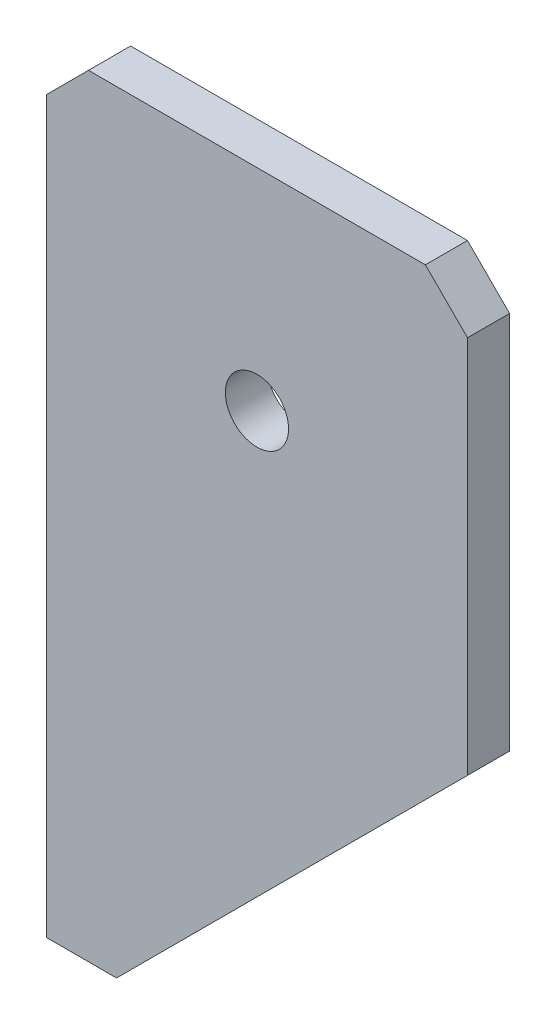
from build123d import *

# Parameters (mm, degrees)
SKETCH1_W           = 30
SKETCH1_H           = 55
BOSS_EXTRUDE1_DEPTH = 1.5
CHAMFER1_SIZE       = 3
SKETCH2_R           = 2.25
CUT_EXTRUDE1_DEPTH  = 10
CHAMFER2_SIZE       = 25


with BuildPart() as part:
    # Sketch1 → Boss-Extrude1 (new, symmetric)
    with BuildSketch(Plane.XY):
        Rectangle(SKETCH1_W, SKETCH1_H)
    extrude(amount=BOSS_EXTRUDE1_DEPTH, both=True)

    # Chamfer1
    chamfer1_edges = [part.edges().sort_by_distance(p)[0] for p in [
        (-15, 27.5, 0),
        (15, 27.5, 0),
    ]]
    chamfer(chamfer1_edges, length=CHAMFER1_SIZE)

    # Sketch2 → Cut-Extrude1 (cut)
    with BuildSketch(Plane.XY.offset(1.5)):
        with Locations((0, 12.5)):
            Circle(SKETCH2_R)
    extrude(amount=-CUT_EXTRUDE1_DEPTH, mode=Mode.SUBTRACT)

    # Chamfer2
    chamfer2_edges = [part.edges().sort_by_distance(p)[0] for p in [
        (15, -27.5, 0),
    ]]
    chamfer(chamfer2_edges, length=CHAMFER2_SIZE)


solid = part.part
